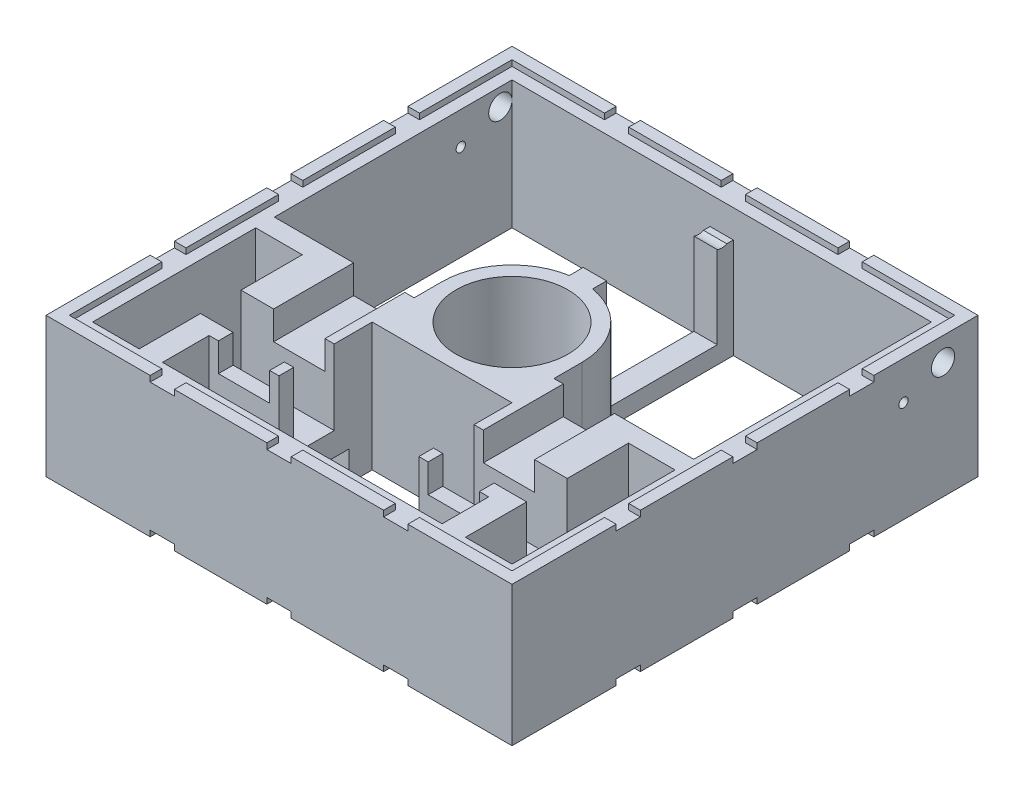
from build123d import *

# Parameters (mm, degrees)
SKETCH1_W                = 127
SKETCH1_H                = 127
SKETCH1_W_2              = 114.3
SKETCH1_H_2              = 114.3
BOSS_EXTRUDE1_DEPTH      = 38.1
BOSS_EXTRUDE2_DEPTH      = 38.1
SKETCH3_R                = 15.24
CUT_EXTRUDE1_DEPTH       = 34.29
CUT_EXTRUDE2_DEPTH       = 25.4
CUT_EXTRUDE3_REACH       = 132.909
CUT_EXTRUDE6_DEPTH       = 1.5875
CUT_EXTRUDE7_REACH       = 101.646
CUT_EXTRUDE8_REACH       = 104.674
SKETCH10_W               = 13.97
SKETCH10_H               = 7.747
CUT_EXTRUDE9_DEPTH       = 9.7155
CUT_EXTRUDE10_START      = -38.1
CUT_EXTRUDE10_DEPTH      = 1.5875
CUT_EXTRUDE11_DEPTH      = 148.013128665
CUT_EXTRUDE11_DEPTH_BACK = 148.013128665
SKETCH12_R               = 3.175
CUT_EXTRUDE12_REACH      = 149.013
SKETCH13_R               = 1.27
CUT_EXTRUDE13_START      = -123.825
SKETCH13_2_R             = 1.27
CUT_EXTRUDE13_DEPTH      = 3.175
CUT_EXTRUDE14_DEPTH      = 11.7475


with BuildPart() as part:
    # Sketch1 → Boss-Extrude1 (new body)
    with BuildSketch(Plane(origin=(0, 0, 0), x_dir=(1, 0, 0), z_dir=(0, 1, 0))):
        Rectangle(SKETCH1_W, SKETCH1_H)
        Rectangle(SKETCH1_W_2, SKETCH1_H_2, mode=Mode.SUBTRACT)
    extrude(amount=BOSS_EXTRUDE1_DEPTH)

    # Sketch2 → Boss-Extrude2 (add)
    with BuildSketch(Plane(origin=(0, 0, 0), x_dir=(1, 0, 0), z_dir=(0, 1, 0))):
        with BuildLine():
            ThreePointArc((-3.175, 18.783553311), (-14.549677831, 12.296722124), (-19.05, 0))
            ThreePointArc((-19.05, 0), (-13.470384176, -13.470384188), (1.7e-08, -19.05))
            Line((0, -19.05), (0, 19.05))
            ThreePointArc((0, 19.05), (-1.593080258, 18.983271459), (-3.175, 18.783553311))
        make_face()
        with BuildLine():
            Line((0, 19.05), (0, -19.05))
            ThreePointArc((1.7e-08, -19.05), (13.470384188, -13.470384176), (19.05, 0))
            ThreePointArc((19.05, 0), (14.549677831, 12.296722124), (3.175, 18.783553311))
            ThreePointArc((3.175, 18.783553311), (1.593080258, 18.983271459), (0, 19.05))
        make_face()
        with BuildLine():
            Line((0, 57.15), (0, 19.05))
            ThreePointArc((0, 19.05), (1.593080258, 18.983271459), (3.175, 18.783553311))
            Line((3.175, 18.783553311), (3.175, 57.15))
            Line((3.175, 57.15), (0, 57.15))
        make_face()
        with BuildLine():
            Line((-3.175, 57.15), (-3.175, 18.783553311))
            ThreePointArc((-3.175, 18.783553311), (-1.593080258, 18.983271459), (0, 19.05))
            Line((0, 19.05), (0, 57.15))
            Line((0, 57.15), (-3.175, 57.15))
        make_face()
        Polygon((-44.45, -57.15), (-44.45, -12.7), (-57.15, -12.7), (-57.15, -7.62), (-19.05, -7.62), (-19.05, -44.45), (-38.1, -44.45), (-38.1, -57.15), align=None)
        Polygon((44.45, -57.15), (38.1, -57.15), (38.1, -44.45), (19.05, -44.45), (19.05, -7.62), (57.15, -7.62), (57.15, -12.7), (44.45, -12.7), align=None)
        with BuildLine():
            Line((-19.05, 0), (-19.05, -7.62))
            Line((-19.05, -7.62), (-19.05, -19.05))
            Line((-19.05, -19.05), (1.7e-08, -19.05))
            ThreePointArc((1.7e-08, -19.05), (-13.470384176, -13.470384188), (-19.05, 0))
        make_face()
        with BuildLine():
            ThreePointArc((19.05, 0), (13.470384188, -13.470384176), (1.7e-08, -19.05))
            Line((1.7e-08, -19.05), (19.05, -19.05))
            Line((19.05, -19.05), (19.05, -7.62))
            Line((19.05, -7.62), (19.05, 0))
        make_face()
    extrude(amount=BOSS_EXTRUDE2_DEPTH)

    # Sketch3 → Cut-Extrude1 (cut)
    with BuildSketch(Plane(origin=(88.9, 38.1, 0), x_dir=(-1, 0, 0), z_dir=(0, -1, 0))):
        with Locations(Location((88.9, 0, 0), (0, 0, 270))):
            Circle(SKETCH3_R)
    extrude(amount=CUT_EXTRUDE1_DEPTH, mode=Mode.SUBTRACT)

    # Sketch4 → Cut-Extrude2 (cut)
    with BuildSketch(Plane(origin=(44.45, 0, 0), x_dir=(0, 0, -1), z_dir=(1, 0, 0))):
        Polygon((-40.4495, 21.59), (-40.4495, 16.0655), (-29.4005, 16.0655), (-29.4005, 21.59), (-29.4005, 38.1), (-40.4495, 38.1), align=None)
    extrude(amount=-CUT_EXTRUDE2_DEPTH, mode=Mode.SUBTRACT)

    # Sketch5 → Cut-Extrude3 (cut, up to next)
    with BuildSketch(Plane.ZY.offset(44.45), mode=Mode.PRIVATE) as cut_extrude3_sk1:
        Polygon((40.4495, 21.59), (40.4495, 38.1), (29.4005, 38.1), (29.4005, 21.59), (29.4005, 16.0655), (40.4495, 16.0655), align=None)
    cut_extrude3_tool1 = extrude(cut_extrude3_sk1.sketch, amount=-CUT_EXTRUDE3_REACH, mode=Mode.PRIVATE) & part.part
    add(cut_extrude3_tool1.solids().sort_by_distance((-44.45, 27.08275, 34.925))[0], mode=Mode.SUBTRACT)

    # Sketch8 → Cut-Extrude6 (cut)
    with BuildSketch(Plane(origin=(0, 38.1, 0), x_dir=(1, 0, 0), z_dir=(0, 1, 0))):
        Polygon((-60.325, 60.325), (-35.1155, 60.325), (-35.1155, 63.5), (-28.5115, 63.5), (-28.5115, 60.325), (-3.302, 60.325), (-3.302, 63.5), (3.302, 63.5), (3.302, 60.325), (28.5115, 60.325), (28.5115, 63.5), (35.1155, 63.5), (35.1155, 60.325), (60.325, 60.325), (60.325, 35.1155), (63.5, 35.1155), (63.5, 28.5115), (60.325, 28.5115), (60.325, 3.302), (63.5, 3.302), (63.5, -3.302), (60.325, -3.302), (60.325, -28.5115), (63.5, -28.5115), (63.5, -35.1155), (60.325, -35.1155), (60.325, -60.325), (35.1155, -60.325), (35.1155, -63.5), (28.5115, -63.5), (28.5115, -60.325), (3.302, -60.325), (3.302, -63.5), (-3.302, -63.5), (-3.302, -60.325), (-28.5115, -60.325), (-28.5115, -63.5), (-35.1155, -63.5), (-35.1155, -60.325), (-60.325, -60.325), (-60.325, -35.1155), (-63.5, -35.1155), (-63.5, -28.5115), (-60.325, -28.5115), (-60.325, -3.302), (-63.5, -3.302), (-63.5, 3.302), (-60.325, 3.302), (-60.325, 28.5115), (-63.5, 28.5115), (-63.5, 35.1155), (-60.325, 35.1155), align=None)
    extrude(amount=-CUT_EXTRUDE6_DEPTH, mode=Mode.SUBTRACT)

    # Sketch9 → Cut-Extrude7 (cut, up to next)
    with BuildSketch(Plane(origin=(3.175, 0, 0), x_dir=(0, 0, -1), z_dir=(1, 0, 0)), mode=Mode.PRIVATE) as cut_extrude7_sk1:
        Polygon((22.593553311, 36.5125), (22.593553311, 6.35), (52.756053311, 6.35), (52.756053311, 28.8925), (57.15, 28.8925), (57.15, 36.5125), (53.34, 36.5125), align=None)
    cut_extrude7_tool1 = extrude(cut_extrude7_sk1.sketch, amount=-CUT_EXTRUDE7_REACH, mode=Mode.PRIVATE) & part.part
    add(cut_extrude7_tool1.solids().sort_by_distance((3.175, 21.831334, -38.288111))[0], mode=Mode.SUBTRACT)

    # Cut-Extrude8: up to this face of the body (flat: up to its plane)
    cut_extrude8_end = Plane(part.part.faces().sort_by_distance((28.575, 18.25625, 44.45))[0])
    # Sketch10 → Cut-Extrude8 (cut, up to the picked face)
    with BuildSketch(Plane(origin=(0, 0, 7.62), x_dir=(-1, 0, 0), z_dir=(0, 0, -1)), mode=Mode.PRIVATE) as cut_extrude8_sk1:
        with Locations((28.575, 32.639)):
            Rectangle(SKETCH10_W, SKETCH10_H)
    cut_extrude8_tool1 = split(extrude(cut_extrude8_sk1.sketch, amount=-CUT_EXTRUDE8_REACH, mode=Mode.PRIVATE), bisect_by=cut_extrude8_end, keep=Keep.BOTH, mode=Mode.PRIVATE)
    # Sketch10 → Cut-Extrude8 (cut, up to the picked face)
    with BuildSketch(Plane(origin=(0, 0, 7.62), x_dir=(-1, 0, 0), z_dir=(0, 0, -1)), mode=Mode.PRIVATE) as cut_extrude8_sk2:
        with Locations((-28.575, 32.639)):
            Rectangle(SKETCH10_W, SKETCH10_H)
    cut_extrude8_tool2 = split(extrude(cut_extrude8_sk2.sketch, amount=-CUT_EXTRUDE8_REACH, mode=Mode.PRIVATE), bisect_by=cut_extrude8_end, keep=Keep.BOTH, mode=Mode.PRIVATE)
    add(cut_extrude8_tool1.solids().sort_by(Axis((-28.575, 32.639, 7.62), (0, 0, 1)))[0], mode=Mode.SUBTRACT)
    add(cut_extrude8_tool2.solids().sort_by(Axis((28.575, 32.639, 7.62), (0, 0, 1)))[0], mode=Mode.SUBTRACT)

    # Sketch11 → Cut-Extrude9 (cut)
    with BuildSketch(Plane.XZ):
        Polygon((25.4, 25.4), (19.05, 25.4), (19.05, 38.1), (38.1, 38.1), (38.1, 7.62), (25.4, 7.62), align=None)
        Polygon((-19.05, 38.1), (-38.1, 38.1), (-38.1, 7.62), (-25.4, 7.62), (-25.4, 25.4), (-19.05, 25.4), align=None)
    extrude(amount=-CUT_EXTRUDE9_DEPTH, mode=Mode.SUBTRACT)

    # Sketch8<2> → Cut-Extrude10 (cut)
    with BuildSketch(Plane(origin=(0, 38.1, 0), x_dir=(1, 0, 0), z_dir=(0, 1, 0)).offset(CUT_EXTRUDE10_START)):
        Polygon((-60.325, 60.325), (-35.1155, 60.325), (-35.1155, 63.5), (-28.5115, 63.5), (-28.5115, 60.325), (-3.302, 60.325), (-3.302, 63.5), (3.302, 63.5), (3.302, 60.325), (28.5115, 60.325), (28.5115, 63.5), (35.1155, 63.5), (35.1155, 60.325), (60.325, 60.325), (60.325, 35.1155), (63.5, 35.1155), (63.5, 28.5115), (60.325, 28.5115), (60.325, 3.302), (63.5, 3.302), (63.5, -3.302), (60.325, -3.302), (60.325, -28.5115), (63.5, -28.5115), (63.5, -35.1155), (60.325, -35.1155), (60.325, -60.325), (35.1155, -60.325), (35.1155, -63.5), (28.5115, -63.5), (28.5115, -60.325), (3.302, -60.325), (3.302, -63.5), (-3.302, -63.5), (-3.302, -60.325), (-28.5115, -60.325), (-28.5115, -63.5), (-35.1155, -63.5), (-35.1155, -60.325), (-60.325, -60.325), (-60.325, -35.1155), (-63.5, -35.1155), (-63.5, -28.5115), (-60.325, -28.5115), (-60.325, -3.302), (-63.5, -3.302), (-63.5, 3.302), (-60.325, 3.302), (-60.325, 28.5115), (-63.5, 28.5115), (-63.5, 35.1155), (-60.325, 35.1155), align=None)
    extrude(amount=CUT_EXTRUDE10_DEPTH, mode=Mode.SUBTRACT)

    # Sketch12 → Cut-Extrude11 (cut, two sides: drawn at the far end of the back side and taken through both)
    with BuildSketch(Plane.ZY.offset(63.5).offset(-CUT_EXTRUDE11_DEPTH_BACK)):
        with Locations(Location((-53.975, 31.75, 0), (0, 0, 180))):
            Circle(SKETCH12_R)
    extrude(amount=CUT_EXTRUDE11_DEPTH + CUT_EXTRUDE11_DEPTH_BACK, mode=Mode.SUBTRACT)

    # Sketch13 → Cut-Extrude12 (cut, up to next)
    with BuildSketch(Plane.ZY.offset(63.5), mode=Mode.PRIVATE) as cut_extrude12_sk1:
        with Locations((-43.18, 27.6225)):
            Circle(SKETCH13_R)
    cut_extrude12_tool1 = extrude(cut_extrude12_sk1.sketch, amount=-CUT_EXTRUDE12_REACH, mode=Mode.PRIVATE) & part.part
    add(cut_extrude12_tool1.solids().sort_by_distance((-63.5, 27.6225, -43.18))[0], mode=Mode.SUBTRACT)

    # Sketch13<2> → Cut-Extrude13 (cut)
    with BuildSketch(Plane.ZY.offset(63.5).offset(CUT_EXTRUDE13_START)):
        with Locations((-43.18, 27.6225)):
            Circle(SKETCH13_2_R)
    extrude(amount=-CUT_EXTRUDE13_DEPTH, mode=Mode.SUBTRACT)

    # Sketch14 → Cut-Extrude14 (cut)
    with BuildSketch(Plane.XZ.offset(-1.5875)):
        with BuildLine():
            Line((-18.748751681, -3.374434827), (-14.878167761, -0.103194359))
            Line((-14.878167761, -0.103194359), (-2.581445637, -14.65287219))
            Line((-2.581445637, -14.65287219), (-6.452029557, -17.924112659))
            ThreePointArc((-6.452029557, -17.924112659), (-14.549677831, -12.296722124), (-18.748751681, -3.374434827))
        make_face()
    extrude(amount=-CUT_EXTRUDE14_DEPTH, mode=Mode.SUBTRACT)


solid = part.part
